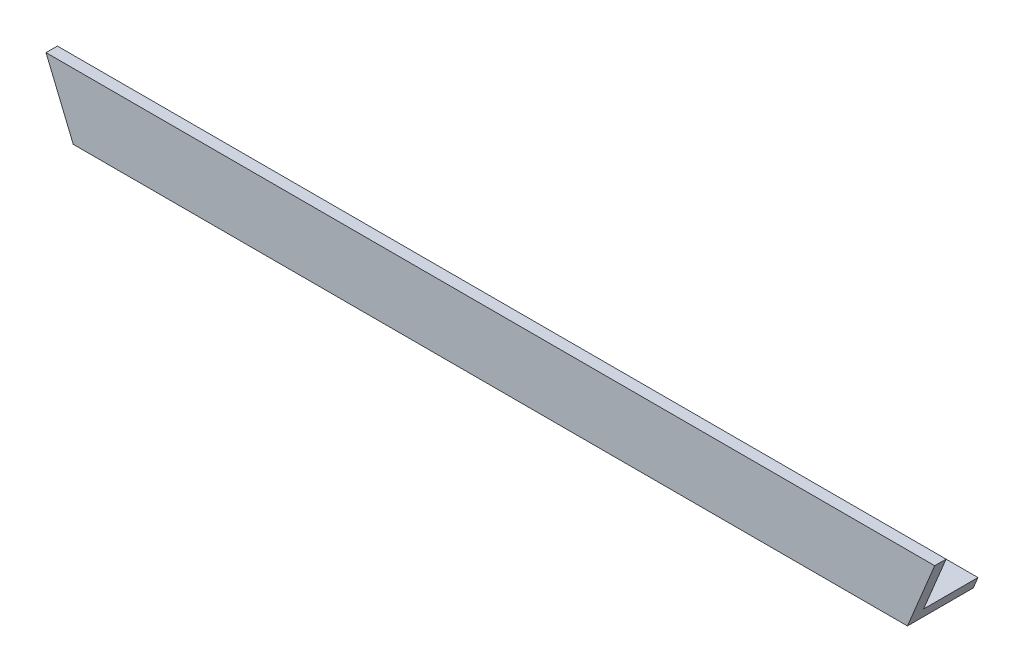
from build123d import *

# Parameters (mm, degrees)
BOSS_EXTRUDE1_DEPTH = 270
CUT_EXTRUDE1_DEPTH  = 272.47743921


with BuildPart() as part:
    # Sketch1 → Boss-Extrude1 (new body)
    with BuildSketch(Plane(origin=(0, 0, 0), x_dir=(0, 0, -1), z_dir=(1, 0, 0))):
        Polygon((0, 0), (20, 0), (20, 3.461178467), (3.461178467, 3.461178467), (3.461178467, 20), (0, 20), align=None)
    extrude(amount=BOSS_EXTRUDE1_DEPTH)

    # Sketch2 → Cut-Extrude1 (cut, through all)
    with BuildSketch(Plane(origin=(0, 0, 0), x_dir=(1, 0, 0), z_dir=(0, 0, -1))):
        Polygon((270, -20), (270, 0), (261.715728753, 0), align=None)
        Polygon((0, -20), (0, 0), (8.284271247, 0), align=None)
    extrude(amount=CUT_EXTRUDE1_DEPTH, mode=Mode.SUBTRACT)


solid = part.part
